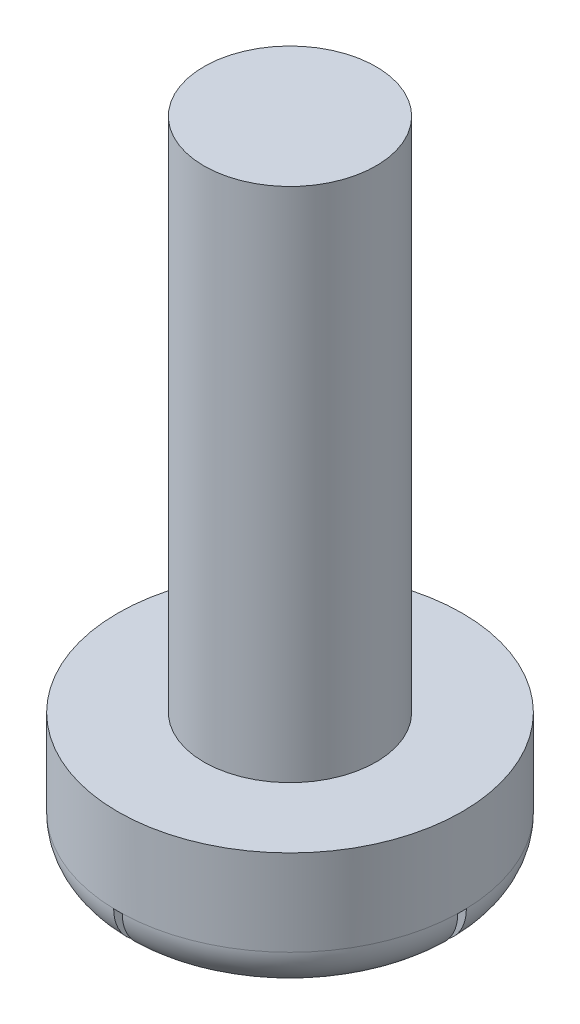
from build123d import *

# Parameters (mm, degrees)
SKETCH_1_R               = 4
EXTRUDE_1_DEPTH          = 3
SKETCH_2_R               = 2
EXTRUDE_2_DEPTH          = 12
CUT_EXTRUDE_1_DEPTH      = 17.031219542
CUT_EXTRUDE_1_DEPTH_BACK = 1
SKETCH_4_W               = 8
SKETCH_4_H               = 0.2
SKETCH_4_W_2             = 0.2
SKETCH_4_H_2             = 8
FILLET_1_R               = 1


with BuildPart() as part:
    # 草图1 → 凸台-拉伸1 (new body)
    with BuildSketch(Plane(origin=(0, 0, 0), x_dir=(1, 0, 0), z_dir=(0, 1, 0))):
        Circle(SKETCH_1_R)
    extrude(amount=-EXTRUDE_1_DEPTH)

    # 草图2 → 凸台-拉伸2 (add)
    with BuildSketch(Plane(origin=(0, 0, 0), x_dir=(1, 0, 0), z_dir=(0, 1, 0))):
        Circle(SKETCH_2_R)
    extrude(amount=EXTRUDE_2_DEPTH)

    # 草图4 → 切除-拉伸-薄壁1 (cut, two sides: drawn at the far end of the back side and taken through both)
    with BuildSketch(Plane.XZ.offset(3).offset(-CUT_EXTRUDE_1_DEPTH_BACK)):
        Rectangle(SKETCH_4_W, SKETCH_4_H)
        Rectangle(SKETCH_4_W_2, SKETCH_4_H_2)
    extrude(amount=CUT_EXTRUDE_1_DEPTH + CUT_EXTRUDE_1_DEPTH_BACK, mode=Mode.SUBTRACT)

    # 圆角1
    fillet_1_edges = [part.edges().sort_by_distance(p)[0] for p in [
        (2.828427125, -3, 2.828427125),
        (-2.828427125, -3, 2.828427125),
        (-2.828427125, -3, -2.828427125),
        (2.828427125, -3, -2.828427125),
    ]]
    fillet(fillet_1_edges, radius=FILLET_1_R)


solid = part.part
